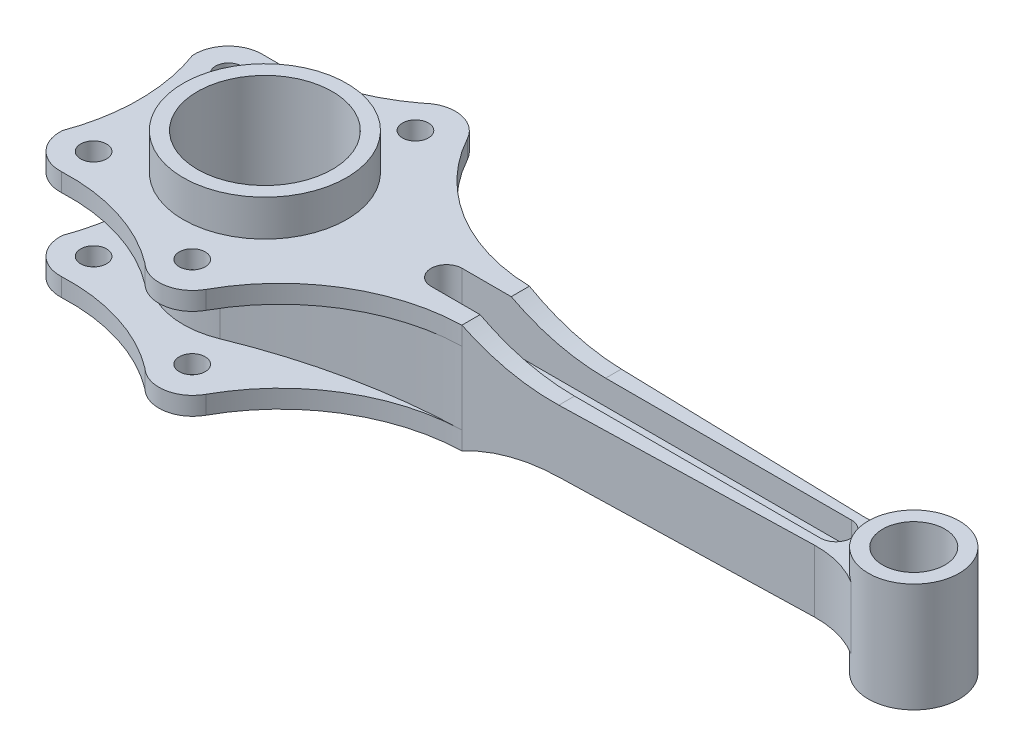
from build123d import *

# Parameters (mm, degrees)
SKETCH1_R               = 5
SKETCH1_R_2             = 31.5
BOSS_EXTRUDE1_DEPTH     = 21
CUT_EXTRUDE1_DEPTH      = 249.276960573
CUT_EXTRUDE1_DEPTH_BACK = 249.276960573
SKETCH1_3_R             = 12
BOSS_EXTRUDE2_DEPTH     = 21
SKETCH1_4_R             = 31.5
SKETCH1_4_R_2           = 26
BOSS_EXTRUDE3_DEPTH     = 35
CUT_EXTRUDE2_START      = 2.5
CUT_EXTRUDE2_DEPTH      = 70
CUT_EXTRUDE3_DEPTH      = 14


with BuildPart() as part:
    # Sketch1 → Boss-Extrude1 (new, symmetric)
    with BuildSketch(Plane(origin=(0, 0, 0), x_dir=(1, 0, 0), z_dir=(0, 1, 0))):
        with BuildLine():
            Line((221.187786225, 9.494895459), (88.904140781, 13.002249852))
            ThreePointArc((88.904140781, 13.002249852), (53.309733953, 23.515221578), (27.680495601, 50.35970916))
            ThreePointArc((27.680495601, 50.35970916), (18.1834351, 56.969515961), (7.179772337, 53.391372602))
            ThreePointArc((7.179772337, 53.391372602), (-14.863061383, 42.091119402), (-39.431134928, 38.930106423))
            ThreePointArc((-39.431134928, 38.930106423), (-49.321982863, 35.019426592), (-52.982993526, 25.033471929))
            ThreePointArc((-52.982993526, 25.033471929), (-48.490958117, 0), (-52.982993526, -25.033471929))
            ThreePointArc((-52.982993526, -25.033471929), (-49.321982863, -35.019426592), (-39.431134928, -38.930106423))
            ThreePointArc((-39.431134928, -38.930106423), (-14.863061383, -42.091119402), (7.179772337, -53.391372602))
            ThreePointArc((7.179772337, -53.391372602), (18.1834351, -56.969515961), (27.680495601, -50.35970916))
            ThreePointArc((27.680495601, -50.35970916), (53.309733953, -23.515221578), (88.904140781, -13.002249852))
            Line((88.904140781, -13.002249852), (221.187786225, -9.494895459))
            ThreePointArc((221.187786225, -9.494895459), (231.340206045, -10.720138116), (240.705148821, -14.827533226))
            ThreePointArc((240.705148821, -14.827533226), (232.5, 0), (240.705148821, 14.827533226))
            ThreePointArc((240.705148821, 14.827533226), (231.340206045, 10.720138116), (221.187786225, 9.494895459))
        make_face()
        with Locations((15, -43)):
            Circle(SKETCH1_R, mode=Mode.SUBTRACT)
        with Locations((-40, -26)):
            Circle(SKETCH1_R, mode=Mode.SUBTRACT)
        Circle(SKETCH1_R_2, mode=Mode.SUBTRACT)
        with Locations((-40, 26)):
            Circle(SKETCH1_R, mode=Mode.SUBTRACT)
        with Locations((15, 43)):
            Circle(SKETCH1_R, mode=Mode.SUBTRACT)
    extrude(amount=BOSS_EXTRUDE1_DEPTH, both=True)

    # Sketch2 → Cut-Extrude1 (cut, two sides: drawn at the far end of the back side and taken through both)
    with BuildSketch(Plane.XY.offset(-CUT_EXTRUDE1_DEPTH_BACK)):
        with BuildLine():
            Line((240.705148821, 21), (221.187786225, 21))
            Line((221.187786225, 21), (88.904140781, 21))
            ThreePointArc((88.904140781, 21), (106.542213745, 14.283423215), (125.27720774, 12))
            Line((125.27720774, 12), (240.705148821, 12))
            Line((240.705148821, 12), (240.705148821, 21))
        make_face()
        with BuildLine():
            Line((240.705148821, -12), (125.27720774, -12))
            ThreePointArc((125.27720774, -12), (106.542213745, -14.283423215), (88.904140781, -21))
            Line((88.904140781, -21), (221.187786225, -21))
            Line((221.187786225, -21), (240.705148821, -21))
            Line((240.705148821, -21), (240.705148821, -12))
        make_face()
    extrude(amount=CUT_EXTRUDE1_DEPTH + CUT_EXTRUDE1_DEPTH_BACK, mode=Mode.SUBTRACT)

    # Sketch1<3> → Boss-Extrude2 (add, symmetric)
    with BuildSketch(Plane(origin=(0, 0, 0), x_dir=(1, 0, 0), z_dir=(0, 1, 0))):
        with BuildLine():
            ThreePointArc((267.5, 0), (258.473196102, 15.311921754), (240.705148821, 14.827533226))
            ThreePointArc((240.705148821, 14.827533226), (232.5, 0), (240.705148821, -14.827533226))
            ThreePointArc((240.705148821, -14.827533226), (258.473196102, -15.311921754), (267.5, 0))
        make_face()
        with Locations((250, 0)):
            Circle(SKETCH1_3_R, mode=Mode.SUBTRACT)
    extrude(amount=BOSS_EXTRUDE2_DEPTH, both=True)

    # Sketch1<4> → Boss-Extrude3 (add, symmetric)
    with BuildSketch(Plane(origin=(0, 0, 0), x_dir=(1, 0, 0), z_dir=(0, 1, 0))):
        Circle(SKETCH1_4_R)
        Circle(SKETCH1_4_R_2, mode=Mode.SUBTRACT)
    extrude(amount=BOSS_EXTRUDE3_DEPTH, both=True)

    # Sketch1<5> → Cut-Extrude2 (cut)
    with BuildSketch(Plane(origin=(0, 0, 0), x_dir=(1, 0, 0), z_dir=(0, 1, 0)).offset(CUT_EXTRUDE2_START)):
        with BuildLine():
            Line((220, 6), (70, 6))
            ThreePointArc((70, 6), (64, 0), (70, -6))
            Line((70, -6), (220, -6))
            ThreePointArc((220, -6), (226, 0), (220, 6))
        make_face()
    cut_extrude2 = extrude(amount=CUT_EXTRUDE2_DEPTH, mode=Mode.SUBTRACT)

    # Mirror1: Cut-Extrude2 across plane
    add(cut_extrude2.mirror(Plane.ZX), mode=Mode.SUBTRACT)

    # Sketch5 → Cut-Extrude3 (cut, symmetric)
    with BuildSketch(Plane(origin=(0, 0, 0), x_dir=(1, 0, 0), z_dir=(0, 1, 0))):
        with BuildLine():
            ThreePointArc((88.904140781, 13.002249852), (49.66976816, 17.602087151), (11.897396977, 29.16679525))
            ThreePointArc((11.897396977, 29.16679525), (-31.5, 0), (11.897396977, -29.16679525))
            ThreePointArc((11.897396977, -29.16679525), (49.66976816, -17.602087151), (88.904140781, -13.002249852))
            ThreePointArc((88.904140781, -13.002249852), (53.309733953, -23.515221578), (27.680495601, -50.35970916))
            ThreePointArc((27.680495601, -50.35970916), (18.1834351, -56.969515961), (7.179772337, -53.391372602))
            ThreePointArc((7.179772337, -53.391372602), (-14.863061383, -42.091119402), (-39.431134928, -38.930106423))
            ThreePointArc((-39.431134928, -38.930106423), (-49.321982863, -35.019426592), (-52.982993526, -25.033471929))
            ThreePointArc((-52.982993526, -25.033471929), (-48.490958117, 0), (-52.982993526, 25.033471929))
            ThreePointArc((-52.982993526, 25.033471929), (-49.321982863, 35.019426592), (-39.431134928, 38.930106423))
            ThreePointArc((-39.431134928, 38.930106423), (-14.863061383, 42.091119402), (7.179772337, 53.391372602))
            ThreePointArc((7.179772337, 53.391372602), (18.1834351, 56.969515961), (27.680495601, 50.35970916))
            ThreePointArc((27.680495601, 50.35970916), (53.309733953, 23.515221578), (88.904140781, 13.002249852))
        make_face()
    extrude(amount=CUT_EXTRUDE3_DEPTH, both=True, mode=Mode.SUBTRACT)


solid = part.part
